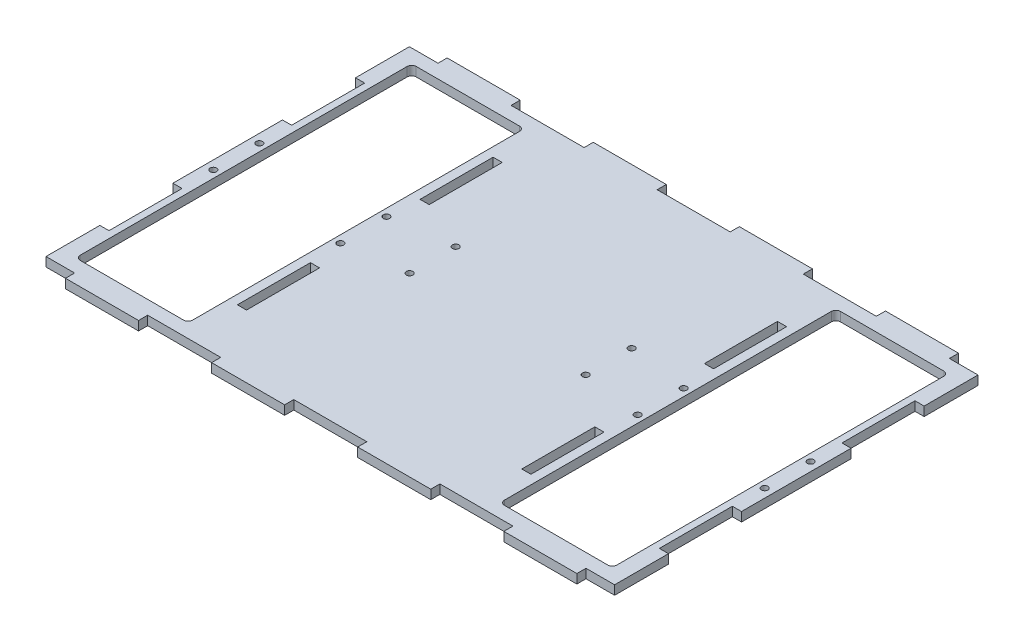
from build123d import *

# Parameters (mm, degrees)
SKETCH5_W             = 395.4
SKETCH5_H             = 265.4
BOSS_EXTRUDE3_DEPTH   = 6.35
SKETCH6_W             = 78.175
SKETCH6_H             = 243.175
SKETCH6_W_2           = 75
SKETCH6_H_2           = 240
CUT_EXTRUDE1_DEPTH    = 6.35
F_4_0MM_DOWEL_HOLE1_D = 4.5
SKETCH10_W            = 6.35
SKETCH10_H            = 50.8
SKETCH10_W_2          = 50.8
SKETCH10_H_2          = 6.35
CUT_EXTRUDE2_DEPTH    = 6.35
SKETCH11_W            = 50.8
SKETCH11_H            = 6.35
CUT_EXTRUDE3_DEPTH    = 6.35
SKETCH12_W            = 78.175
SKETCH12_H            = 4.7625
BOSS_EXTRUDE4_DEPTH   = 6.35
FILLET1_R             = 3.175


with BuildPart() as part:
    # Sketch5 → Boss-Extrude3 (new body)
    with BuildSketch(Plane(origin=(0, 0, 0), x_dir=(1, 0, 0), z_dir=(0, 1, 0))):
        Rectangle(SKETCH5_W, SKETCH5_H)
    extrude(amount=BOSS_EXTRUDE3_DEPTH)

    # Sketch6 → Cut-Extrude1 (cut)
    # profile 1 of 4: a face of its own
    with BuildSketch(Plane(origin=(0, 6.35, 0), x_dir=(1, 0, 0), z_dir=(0, 1, 0))):
        with Locations((147.5, 0)):
            Rectangle(SKETCH6_W, SKETCH6_H)
        with Locations((147.5, 0)):
            Rectangle(SKETCH6_W_2, SKETCH6_H_2, mode=Mode.SUBTRACT)
    # profile 2 of 4: a face of its own
    with BuildSketch(Plane(origin=(0, 6.35, 0), x_dir=(1, 0, 0), z_dir=(0, 1, 0))):
        with Locations((147.5, 0)):
            Rectangle(SKETCH6_W_2, SKETCH6_H_2)
    # profile 3 of 4: a face of its own
    with BuildSketch(Plane(origin=(0, 6.35, 0), x_dir=(1, 0, 0), z_dir=(0, 1, 0))):
        with Locations((-147.5, 0)):
            Rectangle(SKETCH6_W, SKETCH6_H)
        with Locations((-147.5, 0)):
            Rectangle(SKETCH6_W_2, SKETCH6_H_2, mode=Mode.SUBTRACT)
    # profile 4 of 4: a face of its own
    with BuildSketch(Plane(origin=(0, 6.35, 0), x_dir=(1, 0, 0), z_dir=(0, 1, 0))):
        with Locations((-147.5, 0)):
            Rectangle(SKETCH6_W_2, SKETCH6_H_2)
    extrude(amount=-CUT_EXTRUDE1_DEPTH, mode=Mode.SUBTRACT)

    # Ø4.0mm Dowel Hole1 (through all)
    with Locations(Plane(origin=(0, 6.35, 0), x_dir=(1, 0, 0), z_dir=(0, 1, 0))):
        with Locations((191.675, -16), (191.675, 16), (103.325, -16), (103.325, 16), (-191.675, -16), (-191.675, 16), (-103.325, -16), (-103.325, 16), (-61.175, -10), (-61.175, 22), (61.175, 22), (61.175, -10)):
            Hole(F_4_0MM_DOWEL_HOLE1_D / 2)

    # Sketch10 → Cut-Extrude2 (cut)
    with BuildSketch(Plane.XZ):
        with Locations((98.8875, -63.5)):
            Rectangle(SKETCH10_W, SKETCH10_H)
        with Locations((98.8875, 63.5)):
            Rectangle(SKETCH10_W, SKETCH10_H)
        with Locations((-98.8875, 63.5)):
            Rectangle(SKETCH10_W, SKETCH10_H)
        with Locations((-98.8875, -63.5)):
            Rectangle(SKETCH10_W, SKETCH10_H)
        Polygon((197.7, 132.7), (177.8, 132.7), (177.8, 126.35), (191.35, 126.35), (197.7, 126.35), align=None)
        Polygon((127, 132.7), (76.2, 132.7), (76.2, 126.35), (95.7125, 126.35), (102.0625, 126.35), (108.4125, 126.35), (127, 126.35), align=None)
        with Locations((0, 129.525)):
            Rectangle(SKETCH10_W_2, SKETCH10_H_2)
        Polygon((-127, 132.7), (-127, 126.35), (-108.4125, 126.35), (-102.0625, 126.35), (-95.7125, 126.35), (-76.2, 126.35), (-76.2, 132.7), align=None)
        Polygon((-197.7, 126.35), (-191.35, 126.35), (-177.8, 126.35), (-177.8, 132.7), (-197.7, 132.7), align=None)
        Polygon((-177.8, -126.35), (-191.35, -126.35), (-197.7, -126.35), (-197.7, -132.7), (-177.8, -132.7), align=None)
        Polygon((-108.4125, -126.35), (-127, -126.35), (-127, -132.7), (-76.2, -132.7), (-76.2, -126.35), (-95.7125, -126.35), (-102.0625, -126.35), align=None)
        with Locations((0, -129.525)):
            Rectangle(SKETCH10_W_2, SKETCH10_H_2)
        Polygon((76.2, -126.35), (76.2, -132.7), (127, -132.7), (127, -126.35), (108.4125, -126.35), (102.0625, -126.35), (95.7125, -126.35), align=None)
        Polygon((177.8, -126.35), (177.8, -132.7), (197.7, -132.7), (197.7, -126.35), (191.35, -126.35), align=None)
    extrude(amount=-CUT_EXTRUDE2_DEPTH, mode=Mode.SUBTRACT)

    # Sketch11 → Cut-Extrude3 (cut)
    with BuildSketch(Plane(origin=(197.7, 0, 0), x_dir=(0, 0, -1), z_dir=(1, 0, 0))):
        with Locations((-63.5, 3.175)):
            Rectangle(SKETCH11_W, SKETCH11_H)
        with Locations((63.5, 3.175)):
            Rectangle(SKETCH11_W, SKETCH11_H)
    cut_extrude3 = extrude(amount=-CUT_EXTRUDE3_DEPTH, mode=Mode.SUBTRACT)

    # Mirror1: Cut-Extrude3 across plane
    add(cut_extrude3.mirror(Plane(origin=(0, 0, 0), x_dir=(0, 0, 1), z_dir=(1, 0, 0))), mode=Mode.SUBTRACT)

    # Sketch12 → Boss-Extrude4 (add)
    with BuildSketch(Plane.XZ):
        with Locations((147.5, -119.20625)):
            Rectangle(SKETCH12_W, SKETCH12_H)
        with Locations((147.5, 119.20625)):
            Rectangle(SKETCH12_W, SKETCH12_H)
        with Locations((-147.5, 119.20625)):
            Rectangle(SKETCH12_W, SKETCH12_H)
        with Locations((-147.5, -119.20625)):
            Rectangle(SKETCH12_W, SKETCH12_H)
    extrude(amount=-BOSS_EXTRUDE4_DEPTH)

    # Fillet1
    fillet1_edges = [part.edges().sort_by_distance(p)[0] for p in [
        (108.4125, 3.175, -116.825),
        (186.5875, 3.175, -116.825),
        (186.5875, 3.175, 116.825),
        (108.4125, 3.175, 116.825),
        (-186.5875, 3.175, 116.825),
        (-108.4125, 3.175, 116.825),
        (-108.4125, 3.175, -116.825),
        (-186.5875, 3.175, -116.825),
    ]]
    fillet(fillet1_edges, radius=FILLET1_R)


solid = part.part
